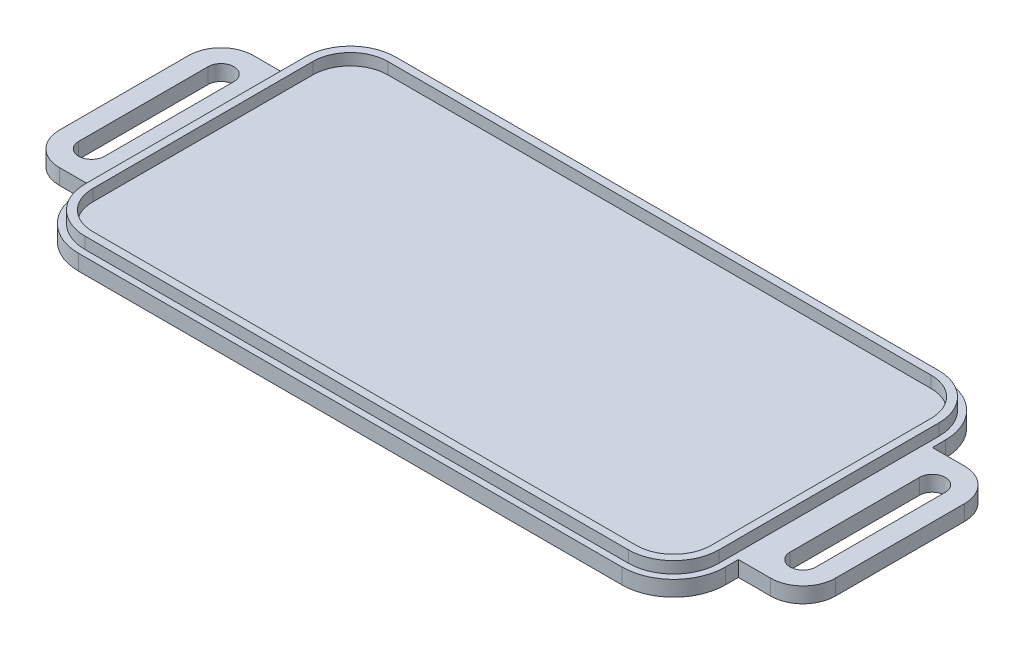
from build123d import *

# Parameters (mm, degrees)
BOSS_EXTRUDE1_DEPTH = 1.2
FILLET1_R           = 4
FILLET2_R           = 2.5
BOSS_EXTRUDE2_DEPTH = 0.9
CUT_EXTRUDE1_DEPTH  = 0.9
CUT_EXTRUDE2_DEPTH  = 86.698804049


with BuildPart() as part:
    # Sketch1 → Boss-Extrude1 (new body)
    with BuildSketch(Plane(origin=(0, 0, 0), x_dir=(1, 0, 0), z_dir=(0, 1, 0))):
        Polygon((-59.653240417, 31.238807945), (-9.653240417, 31.238807945), (-9.653240417, 36.238807945), (-4.653240417, 36.238807945), (-4.653240417, 51.238807945), (-9.653240417, 51.238807945), (-9.653240417, 56.238807945), (-59.653240417, 56.238807945), (-59.653240417, 51.238807945), (-64.653240417, 51.238807945), (-64.653240417, 36.238807945), (-59.653240417, 36.238807945), align=None)
    extrude(amount=BOSS_EXTRUDE1_DEPTH)

    # Fillet1
    fillet1_edges = [part.edges().sort_by_distance(p)[0] for p in [
        (-59.653240417, 0.6, -56.238807945),
        (-9.653240417, 0.6, -56.238807945),
        (-9.653240417, 0.6, -31.238807945),
        (-59.653240417, 0.6, -31.238807945),
    ]]
    fillet(fillet1_edges, radius=FILLET1_R)

    # Fillet2
    fillet2_edges = [part.edges().sort_by_distance(p)[0] for p in [
        (-64.653240417, 0.6, -36.238807945),
        (-64.653240417, 0.6, -51.238807945),
        (-4.653240417, 0.6, -51.238807945),
        (-4.653240417, 0.6, -36.238807945),
    ]]
    fillet(fillet2_edges, radius=FILLET2_R)

    # Sketch4 → Boss-Extrude2 (add)
    with BuildSketch(Plane(origin=(0, 1.2, 0), x_dir=(1, 0, 0), z_dir=(0, 1, 0))):
        with BuildLine():
            Line((-59.153240417, 50.738807945), (-59.153240417, 36.738807945))
            Line((-59.153240417, 36.738807945), (-59.153240417, 35.238807945))
            ThreePointArc((-59.153240417, 35.238807945), (-58.128114151, 32.763934211), (-55.653240417, 31.738807945))
            Line((-55.653240417, 31.738807945), (-13.653240417, 31.738807945))
            ThreePointArc((-13.653240417, 31.738807945), (-11.178366683, 32.763934211), (-10.153240417, 35.238807945))
            Line((-10.153240417, 35.238807945), (-10.153240417, 36.738807945))
            Line((-10.153240417, 36.738807945), (-10.153240417, 50.738807945))
            Line((-10.153240417, 50.738807945), (-10.153240417, 52.238807945))
            ThreePointArc((-10.153240417, 52.238807945), (-11.178366683, 54.713681679), (-13.653240417, 55.738807945))
            Line((-13.653240417, 55.738807945), (-55.653240417, 55.738807945))
            ThreePointArc((-55.653240417, 55.738807945), (-58.128114151, 54.713681679), (-59.153240417, 52.238807945))
            Line((-59.153240417, 52.238807945), (-59.153240417, 50.738807945))
        make_face()
    extrude(amount=BOSS_EXTRUDE2_DEPTH)

    # Sketch5 → Cut-Extrude1 (cut)
    with BuildSketch(Plane(origin=(0, 2.1, 0), x_dir=(1, 0, 0), z_dir=(0, 1, 0))):
        with BuildLine():
            Line((-58.553240417, 52.238807945), (-58.553240417, 35.238807945))
            ThreePointArc((-58.553240417, 35.238807945), (-57.703850082, 33.18819828), (-55.653240417, 32.338807945))
            Line((-55.653240417, 32.338807945), (-13.653240417, 32.338807945))
            ThreePointArc((-13.653240417, 32.338807945), (-11.602630751, 33.18819828), (-10.753240417, 35.238807945))
            Line((-10.753240417, 35.238807945), (-10.753240417, 52.238807945))
            ThreePointArc((-10.753240417, 52.238807945), (-11.602630751, 54.289417611), (-13.653240417, 55.138807945))
            Line((-13.653240417, 55.138807945), (-55.653240417, 55.138807945))
            ThreePointArc((-55.653240417, 55.138807945), (-57.703850082, 54.289417611), (-58.553240417, 52.238807945))
        make_face()
    extrude(amount=-CUT_EXTRUDE1_DEPTH, mode=Mode.SUBTRACT)

    # Sketch6 → Cut-Extrude2 (cut, through all)
    with BuildSketch(Plane(origin=(0, 1.2, 0), x_dir=(1, 0, 0), z_dir=(0, 1, 0))):
        with BuildLine():
            Line((-63.153240417, 48.738807945), (-63.153240417, 38.738807945))
            ThreePointArc((-63.153240417, 38.738807945), (-62.153240417, 37.738807945), (-61.153240417, 38.738807945))
            Line((-61.153240417, 38.738807945), (-61.153240417, 48.738807945))
            ThreePointArc((-61.153240417, 48.738807945), (-62.153240417, 49.738807945), (-63.153240417, 48.738807945))
        make_face()
        with BuildLine():
            Line((-8.153185775, 48.728354232), (-8.153240417, 38.738807945))
            ThreePointArc((-8.153240417, 38.738807945), (-7.153245887, 37.738807945), (-6.153240417, 38.738807945))
            Line((-6.153240417, 38.738807945), (-6.153240417, 48.738807945))
            ThreePointArc((-6.153240417, 48.738807945), (-7.158467345, 49.738794285), (-8.153185775, 48.728354232))
        make_face()
    extrude(amount=-CUT_EXTRUDE2_DEPTH, mode=Mode.SUBTRACT)


solid = part.part
